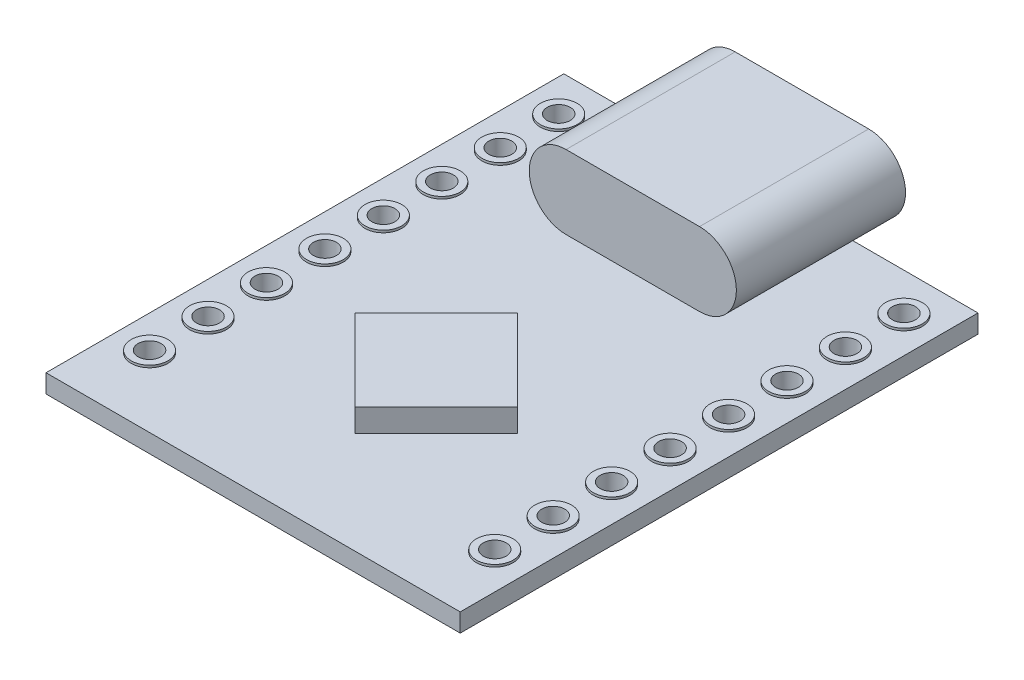
from build123d import *

# Parameters (mm, degrees)
SKETCH1_W                = 18
SKETCH1_H                = 22.5
BOSS_EXTRUDE1_DEPTH      = 0.4
CUT_EXTRUDE1_DEPTH       = 15.429223818
CUT_EXTRUDE1_DEPTH_BACK  = 15.429223818
SKETCH2_R                = 0.5
BOSS_EXTRUDE2_DEPTH      = 1.35
BOSS_EXTRUDE2_DEPTH_BACK = 6
CUT_EXTRUDE2_DEPTH       = 26.744562533
CUT_EXTRUDE2_DEPTH_BACK  = 7
BOSS_EXTRUDE3_DEPTH      = 1
BOSS_EXTRUDE4_DEPTH      = 0.1
BOSS_EXTRUDE4_DEPTH_BACK = 0.9
SKETCH6_R                = 0.8
SKETCH6_R_2              = 0.5


with BuildPart() as part:
    # Sketch1 → Boss-Extrude1 (new, symmetric)
    with BuildSketch(Plane(origin=(0, 0, 0), x_dir=(1, 0, 0), z_dir=(0, 1, 0))):
        Rectangle(SKETCH1_W, SKETCH1_H)
    extrude(amount=BOSS_EXTRUDE1_DEPTH, both=True)

    # Sketch2 → Cut-Extrude1 (cut, two sides: drawn at the far end of the back side and taken through both)
    with BuildSketch(Plane(origin=(0, 0.4, 0), x_dir=(1, 0, 0), z_dir=(0, 1, 0)).offset(-CUT_EXTRUDE1_DEPTH_BACK)):
        with Locations(Location((7.5, -8.25, 0), (0, 0, 270))):
            Circle(SKETCH2_R)
        with Locations(Location((-7.5, -8.25, 0), (0, 0, 270))):
            Circle(SKETCH2_R)
        with Locations(Location((-7.5, -5.71, 0), (0, 0, 270))):
            Circle(SKETCH2_R)
        with Locations(Location((7.5, -5.71, 0), (0, 0, 270))):
            Circle(SKETCH2_R)
        with Locations(Location((-7.5, -3.17, 0), (0, 0, 270))):
            Circle(SKETCH2_R)
        with Locations(Location((7.5, -3.17, 0), (0, 0, 270))):
            Circle(SKETCH2_R)
        with Locations(Location((-7.5, -0.63, 0), (0, 0, 270))):
            Circle(SKETCH2_R)
        with Locations(Location((7.5, -0.63, 0), (0, 0, 270))):
            Circle(SKETCH2_R)
        with Locations(Location((-7.5, 1.91, 0), (0, 0, 270))):
            Circle(SKETCH2_R)
        with Locations(Location((7.5, 1.91, 0), (0, 0, 270))):
            Circle(SKETCH2_R)
        with Locations(Location((-7.5, 4.45, 0), (0, 0, 270))):
            Circle(SKETCH2_R)
        with Locations(Location((7.5, 4.45, 0), (0, 0, 270))):
            Circle(SKETCH2_R)
        with Locations(Location((-7.5, 6.99, 0), (0, 0, 270))):
            Circle(SKETCH2_R)
        with Locations(Location((7.5, 6.99, 0), (0, 0, 270))):
            Circle(SKETCH2_R)
        with Locations(Location((-7.5, 9.53, 0), (0, 0, 270))):
            Circle(SKETCH2_R)
        with Locations(Location((7.5, 9.53, 0), (0, 0, 270))):
            Circle(SKETCH2_R)
    extrude(amount=CUT_EXTRUDE1_DEPTH + CUT_EXTRUDE1_DEPTH_BACK, mode=Mode.SUBTRACT)

    # Sketch3 → Boss-Extrude2 (add, two sides: drawn at the far end of the back side and taken through both)
    with BuildSketch(Plane(origin=(0, 0, -11.25), x_dir=(-1, 0, 0), z_dir=(0, 0, -1)).offset(-BOSS_EXTRUDE2_DEPTH_BACK)):
        with BuildLine():
            Line((-2.9, 3.6), (2.9, 3.6))
            ThreePointArc((2.9, 3.6), (4.5, 2), (2.9, 0.4))
            Line((2.9, 0.4), (-2.9, 0.4))
            ThreePointArc((-2.9, 0.4), (-4.5, 2), (-2.9, 3.6))
        make_face()
    extrude(amount=BOSS_EXTRUDE2_DEPTH + BOSS_EXTRUDE2_DEPTH_BACK)

    # Sketch4 → Cut-Extrude2 (cut, two sides: drawn at the far end of the back side and taken through both)
    with BuildSketch(Plane(origin=(0, 0, -12.6), x_dir=(-1, 0, 0), z_dir=(0, 0, -1)).offset(-CUT_EXTRUDE2_DEPTH_BACK)):
        with BuildLine():
            Line((-2.9, 0.8), (2.9, 0.8))
            ThreePointArc((2.9, 0.8), (4.1, 2), (2.9, 3.2))
            Line((2.9, 3.2), (-2.9, 3.2))
            ThreePointArc((-2.9, 3.2), (-4.1, 2), (-2.9, 0.8))
        make_face()
    extrude(amount=CUT_EXTRUDE2_DEPTH + CUT_EXTRUDE2_DEPTH_BACK, mode=Mode.SUBTRACT)

    # Sketch5 → Boss-Extrude3 (add)
    with BuildSketch(Plane(origin=(0, 0.4, 0), x_dir=(1, 0, 0), z_dir=(0, 1, 0))):
        Polygon((-3.542790315, -3.285533906), (-0.00725641, -6.821067812), (3.528277496, -3.285533906), (-0.00725641, 0.25), align=None)
    extrude(amount=BOSS_EXTRUDE3_DEPTH)

    # Sketch6 → Boss-Extrude4 (add, two sides: drawn at the far end of the back side and taken through both)
    # profile 1 of 16: a face of its own
    with BuildSketch(Plane(origin=(0, 0.4, 0), x_dir=(1, 0, 0), z_dir=(0, 1, 0)).offset(-BOSS_EXTRUDE4_DEPTH_BACK)):
        with Locations(Location((-7.5, -8.25, 0), (0, 0, 270))):
            Circle(SKETCH6_R)
        with Locations(Location((-7.5, -8.25, 0), (0, 0, 270))):
            Circle(SKETCH6_R_2, mode=Mode.SUBTRACT)
    # profile 2 of 16: a face of its own
    with BuildSketch(Plane(origin=(0, 0.4, 0), x_dir=(1, 0, 0), z_dir=(0, 1, 0)).offset(-BOSS_EXTRUDE4_DEPTH_BACK)):
        with Locations(Location((7.5, -8.25, 0), (0, 0, 270))):
            Circle(SKETCH6_R)
        with Locations(Location((7.5, -8.25, 0), (0, 0, 90))):
            Circle(SKETCH6_R_2, mode=Mode.SUBTRACT)
    # profile 3 of 16: a face of its own
    with BuildSketch(Plane(origin=(0, 0.4, 0), x_dir=(1, 0, 0), z_dir=(0, 1, 0)).offset(-BOSS_EXTRUDE4_DEPTH_BACK)):
        with Locations(Location((7.5, -5.71, 0), (0, 0, 270))):
            Circle(SKETCH6_R)
        with Locations(Location((7.5, -5.71, 0), (0, 0, 90))):
            Circle(SKETCH6_R_2, mode=Mode.SUBTRACT)
    # profile 4 of 16: a face of its own
    with BuildSketch(Plane(origin=(0, 0.4, 0), x_dir=(1, 0, 0), z_dir=(0, 1, 0)).offset(-BOSS_EXTRUDE4_DEPTH_BACK)):
        with Locations(Location((-7.5, -5.71, 0), (0, 0, 270))):
            Circle(SKETCH6_R)
        with Locations(Location((-7.5, -5.71, 0), (0, 0, 270))):
            Circle(SKETCH6_R_2, mode=Mode.SUBTRACT)
    # profile 5 of 16: a face of its own
    with BuildSketch(Plane(origin=(0, 0.4, 0), x_dir=(1, 0, 0), z_dir=(0, 1, 0)).offset(-BOSS_EXTRUDE4_DEPTH_BACK)):
        with Locations(Location((7.5, -3.17, 0), (0, 0, 270))):
            Circle(SKETCH6_R)
        with Locations(Location((7.5, -3.17, 0), (0, 0, 90))):
            Circle(SKETCH6_R_2, mode=Mode.SUBTRACT)
    # profile 6 of 16: a face of its own
    with BuildSketch(Plane(origin=(0, 0.4, 0), x_dir=(1, 0, 0), z_dir=(0, 1, 0)).offset(-BOSS_EXTRUDE4_DEPTH_BACK)):
        with Locations(Location((-7.5, -3.17, 0), (0, 0, 270))):
            Circle(SKETCH6_R)
        with Locations(Location((-7.5, -3.17, 0), (0, 0, 270))):
            Circle(SKETCH6_R_2, mode=Mode.SUBTRACT)
    # profile 7 of 16: a face of its own
    with BuildSketch(Plane(origin=(0, 0.4, 0), x_dir=(1, 0, 0), z_dir=(0, 1, 0)).offset(-BOSS_EXTRUDE4_DEPTH_BACK)):
        with Locations(Location((7.5, -0.63, 0), (0, 0, 270))):
            Circle(SKETCH6_R)
        with Locations(Location((7.5, -0.63, 0), (0, 0, 90))):
            Circle(SKETCH6_R_2, mode=Mode.SUBTRACT)
    # profile 8 of 16: a face of its own
    with BuildSketch(Plane(origin=(0, 0.4, 0), x_dir=(1, 0, 0), z_dir=(0, 1, 0)).offset(-BOSS_EXTRUDE4_DEPTH_BACK)):
        with Locations(Location((-7.5, -0.63, 0), (0, 0, 270))):
            Circle(SKETCH6_R)
        with Locations(Location((-7.5, -0.63, 0), (0, 0, 270))):
            Circle(SKETCH6_R_2, mode=Mode.SUBTRACT)
    # profile 9 of 16: a face of its own
    with BuildSketch(Plane(origin=(0, 0.4, 0), x_dir=(1, 0, 0), z_dir=(0, 1, 0)).offset(-BOSS_EXTRUDE4_DEPTH_BACK)):
        with Locations(Location((7.5, 1.91, 0), (0, 0, 270))):
            Circle(SKETCH6_R)
        with Locations(Location((7.5, 1.91, 0), (0, 0, 90))):
            Circle(SKETCH6_R_2, mode=Mode.SUBTRACT)
    # profile 10 of 16: a face of its own
    with BuildSketch(Plane(origin=(0, 0.4, 0), x_dir=(1, 0, 0), z_dir=(0, 1, 0)).offset(-BOSS_EXTRUDE4_DEPTH_BACK)):
        with Locations(Location((-7.5, 1.91, 0), (0, 0, 270))):
            Circle(SKETCH6_R)
        with Locations(Location((-7.5, 1.91, 0), (0, 0, 270))):
            Circle(SKETCH6_R_2, mode=Mode.SUBTRACT)
    # profile 11 of 16: a face of its own
    with BuildSketch(Plane(origin=(0, 0.4, 0), x_dir=(1, 0, 0), z_dir=(0, 1, 0)).offset(-BOSS_EXTRUDE4_DEPTH_BACK)):
        with Locations(Location((7.5, 4.45, 0), (0, 0, 270))):
            Circle(SKETCH6_R)
        with Locations(Location((7.5, 4.45, 0), (0, 0, 90))):
            Circle(SKETCH6_R_2, mode=Mode.SUBTRACT)
    # profile 12 of 16: a face of its own
    with BuildSketch(Plane(origin=(0, 0.4, 0), x_dir=(1, 0, 0), z_dir=(0, 1, 0)).offset(-BOSS_EXTRUDE4_DEPTH_BACK)):
        with Locations(Location((-7.5, 4.45, 0), (0, 0, 270))):
            Circle(SKETCH6_R)
        with Locations(Location((-7.5, 4.45, 0), (0, 0, 270))):
            Circle(SKETCH6_R_2, mode=Mode.SUBTRACT)
    # profile 13 of 16: a face of its own
    with BuildSketch(Plane(origin=(0, 0.4, 0), x_dir=(1, 0, 0), z_dir=(0, 1, 0)).offset(-BOSS_EXTRUDE4_DEPTH_BACK)):
        with Locations(Location((7.5, 6.99, 0), (0, 0, 270))):
            Circle(SKETCH6_R)
        with Locations(Location((7.5, 6.99, 0), (0, 0, 90))):
            Circle(SKETCH6_R_2, mode=Mode.SUBTRACT)
    # profile 14 of 16: a face of its own
    with BuildSketch(Plane(origin=(0, 0.4, 0), x_dir=(1, 0, 0), z_dir=(0, 1, 0)).offset(-BOSS_EXTRUDE4_DEPTH_BACK)):
        with Locations(Location((-7.5, 6.99, 0), (0, 0, 270))):
            Circle(SKETCH6_R)
        with Locations(Location((-7.5, 6.99, 0), (0, 0, 270))):
            Circle(SKETCH6_R_2, mode=Mode.SUBTRACT)
    # profile 15 of 16: a face of its own
    with BuildSketch(Plane(origin=(0, 0.4, 0), x_dir=(1, 0, 0), z_dir=(0, 1, 0)).offset(-BOSS_EXTRUDE4_DEPTH_BACK)):
        with Locations(Location((7.5, 9.53, 0), (0, 0, 270))):
            Circle(SKETCH6_R)
        with Locations(Location((7.5, 9.53, 0), (0, 0, 90))):
            Circle(SKETCH6_R_2, mode=Mode.SUBTRACT)
    # profile 16 of 16: a face of its own
    with BuildSketch(Plane(origin=(0, 0.4, 0), x_dir=(1, 0, 0), z_dir=(0, 1, 0)).offset(-BOSS_EXTRUDE4_DEPTH_BACK)):
        with Locations(Location((-7.5, 9.53, 0), (0, 0, 270))):
            Circle(SKETCH6_R)
        with Locations(Location((-7.5, 9.53, 0), (0, 0, 270))):
            Circle(SKETCH6_R_2, mode=Mode.SUBTRACT)
    extrude(amount=BOSS_EXTRUDE4_DEPTH + BOSS_EXTRUDE4_DEPTH_BACK)


solid = part.part
